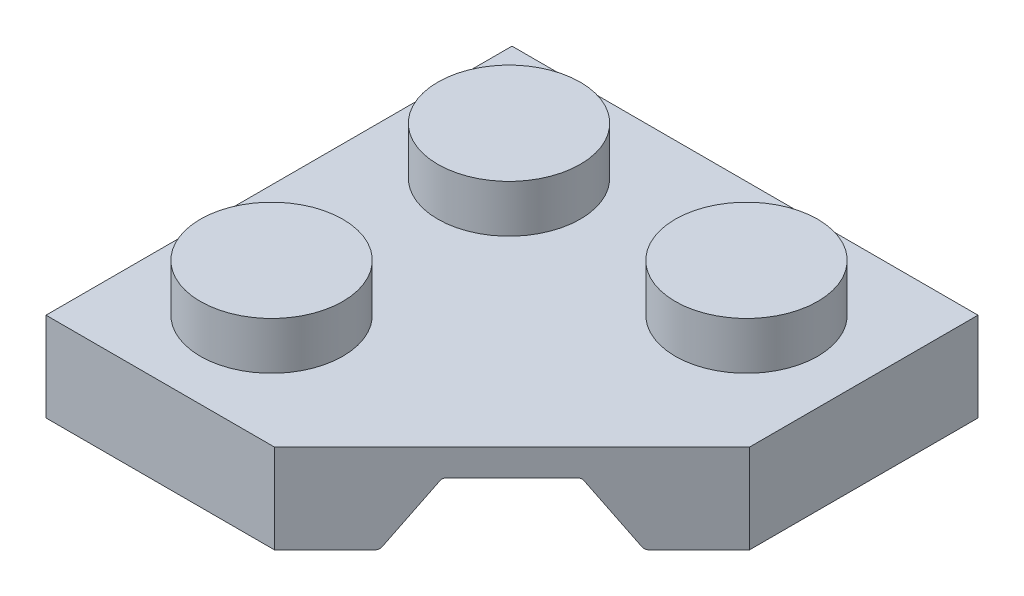
from build123d import *

# Parameters (mm, degrees)
SKETCH1_W               = 15.7
SKETCH1_H               = 15.7
BOSS_EXTRUDE1_DEPTH     = 1.5
SKETCH3_R               = 2.4
BOSS_EXTRUDE2_DEPTH     = 1.6
CUT_EXTRUDE1_DEPTH      = 2.1
CUT_EXTRUDE2_DEPTH      = 13.016863151
LPATTERN2_COUNT         = 2
LPATTERN2_PITCH         = 8
LPATTERN2_COUNT_DIR2    = 2
LPATTERN2_PITCH_DIR2    = 8
SKETCH7_R               = 1.5
SKETCH7_R_2             = 1
BOSS_EXTRUDE3_DEPTH     = 1.9
SKETCH10_R              = 1.3
CUT_EXTRUDE3_DEPTH      = 1.7
LPATTERN3_COUNT         = 2
LPATTERN3_PITCH         = 8
LPATTERN3_COUNT_DIR2    = 2
LPATTERN3_PITCH_DIR2    = 8
CUT_EXTRUDE4_DEPTH      = 17.832145471
CUT_EXTRUDE4_DEPTH_BACK = 1.7
FILLET1_R               = 0.2


with BuildPart() as part:
    # Sketch1 → Boss-Extrude1 (new, symmetric)
    with BuildSketch(Plane(origin=(0, 0, 0), x_dir=(1, 0, 0), z_dir=(0, 1, 0))):
        Rectangle(SKETCH1_W, SKETCH1_H)
    extrude(amount=BOSS_EXTRUDE1_DEPTH, both=True)

    # Sketch3 → Boss-Extrude2 (add)
    with BuildSketch(Plane(origin=(0, 1.5, 0), x_dir=(1, 0, 0), z_dir=(0, 1, 0))):
        with Locations(Location((3.95, 3.95, 0), (0, 0, 90))):
            Circle(SKETCH3_R)
    boss_extrude2 = extrude(amount=BOSS_EXTRUDE2_DEPTH)

    # Sketch4 → Cut-Extrude1 (cut)
    with BuildSketch(Plane.XZ.offset(1.5)):
        Polygon((-7.15, 7.15), (-1.15, 7.15), (7.15, -1.15), (7.15, -7.15), (-7.15, -7.15), align=None)
    extrude(amount=-CUT_EXTRUDE1_DEPTH, mode=Mode.SUBTRACT)

    # Sketch6 → Cut-Extrude2 (cut, through all)
    with BuildSketch(Plane.XZ.offset(1.5)):
        Polygon((-0.152943725, 7.85), (7.85, -0.152943725), (7.85, 7.85), align=None)
    extrude(amount=-CUT_EXTRUDE2_DEPTH, mode=Mode.SUBTRACT)

    # LPattern2: Boss-Extrude2 2 × 2, 1 skipped
    with Locations(*[(-i * LPATTERN2_PITCH, 0, j * LPATTERN2_PITCH_DIR2) for i in range(LPATTERN2_COUNT) for j in range(LPATTERN2_COUNT_DIR2) if (i, j) not in ((0, 0), (0, 1))]):
        add(boss_extrude2)

    # Sketch7 → Boss-Extrude3 (add)
    with BuildSketch(Plane.XZ.offset(-0.6)):
        with Locations(Location((0, 0, 0), (0, 0, 270))):
            Circle(SKETCH7_R)
        with Locations(Location((0, 0, 0), (0, 0, 270))):
            Circle(SKETCH7_R_2, mode=Mode.SUBTRACT)
    extrude(amount=BOSS_EXTRUDE3_DEPTH)

    # Sketch10 → Cut-Extrude3 (cut)
    with BuildSketch(Plane.XZ.offset(-0.6)):
        with Locations(Location((-3.95, 3.95, 0), (0, 0, 270))):
            Circle(SKETCH10_R)
    cut_extrude3 = extrude(amount=-CUT_EXTRUDE3_DEPTH, mode=Mode.SUBTRACT)

    # LPattern3: Cut-Extrude3 2 × 2, 1 skipped
    with Locations(*[(j * LPATTERN3_PITCH_DIR2, 0, -i * LPATTERN3_PITCH) for i in range(LPATTERN3_COUNT) for j in range(LPATTERN3_COUNT_DIR2) if (i, j) not in ((0, 0), (0, 1))]):
        add(cut_extrude3, mode=Mode.SUBTRACT)

    # Sketch11 → Cut-Extrude4 (cut, two sides: drawn at the far end of the back side and taken through both)
    with BuildSketch(Plane(origin=(3.848528137, 0, 3.848528137), x_dir=(0.7071067811865478, 0, -0.7071067811865475), z_dir=(0.7071067811865475, 0, 0.7071067811865478)).offset(-CUT_EXTRUDE4_DEPTH_BACK)):
        Polygon((-26.389939678, -34.02340546), (-3.158935778, -1.5), (-1.658935778, 0.6), (1.658935778, 0.6), (3.158935778, -1.5), (26.389939678, -34.02340546), (26.389939678, -113.959666192), (-26.389939678, -113.959666192), align=None)
    extrude(amount=CUT_EXTRUDE4_DEPTH + CUT_EXTRUDE4_DEPTH_BACK, mode=Mode.SUBTRACT)

    # Fillet1
    fillet1_edges = [part.edges().sort_by_distance(p)[0] for p in [
        (4.597308807, 0.6, 2.251219331),
        (1.190559159, -1.5, 5.657968978),
        (5.657968978, -1.5, 1.190559159),
        (2.251219331, 0.6, 4.597308807),
    ]]
    fillet(fillet1_edges, radius=FILLET1_R)


solid = part.part
